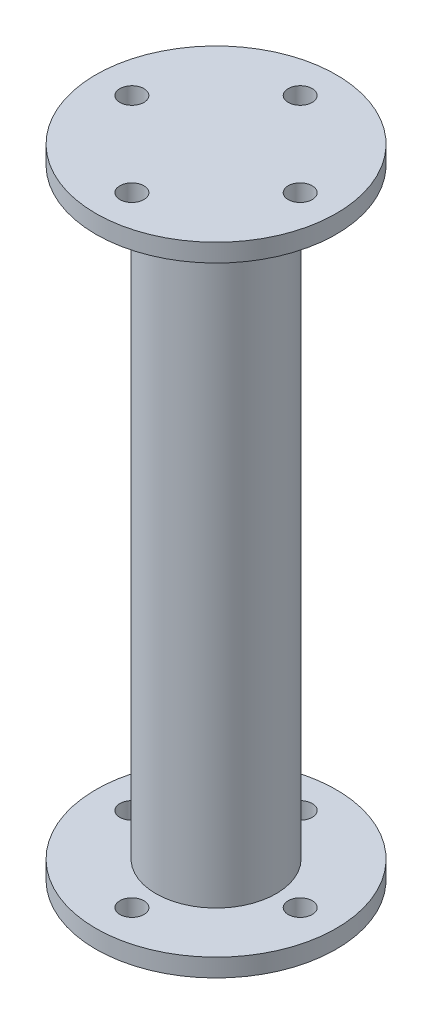
from build123d import *

# Parameters (mm, degrees)
SKETCH1_R           = 10
SKETCH1_R_2         = 2
SKETCH1_R_3         = 1
BOSS_EXTRUDE1_DEPTH = 1.5
SKETCH2_R           = 5
BOSS_EXTRUDE2_DEPTH = 50


with BuildPart() as part:
    # Sketch1 → Boss-Extrude1 (new body)
    # profile 1 of 2: a face of its own
    with BuildSketch(Plane(origin=(0, 0, 0), x_dir=(1, 0, 0), z_dir=(0, 1, 0))):
        with Locations(Location((0, 0, 0), (0, 0, 270))):
            Circle(SKETCH1_R)
        Circle(SKETCH1_R_2, mode=Mode.SUBTRACT)
        with Locations(Location((0, -7, 0), (0, 0, 270))):
            Circle(SKETCH1_R_3, mode=Mode.SUBTRACT)
        with Locations(Location((7, 0, 0), (0, 0, 270))):
            Circle(SKETCH1_R_3, mode=Mode.SUBTRACT)
        with Locations(Location((0, 7, 0), (0, 0, 270))):
            Circle(SKETCH1_R_3, mode=Mode.SUBTRACT)
        with Locations(Location((-7, 0, 0), (0, 0, 270))):
            Circle(SKETCH1_R_3, mode=Mode.SUBTRACT)
    # profile 2 of 2: a face of its own
    with BuildSketch(Plane(origin=(0, 0, 0), x_dir=(1, 0, 0), z_dir=(0, 1, 0))):
        Circle(SKETCH1_R_2)
    boss_extrude1 = extrude(amount=BOSS_EXTRUDE1_DEPTH)

    # Sketch2 → Boss-Extrude2 (add)
    with BuildSketch(Plane(origin=(0, 1.5, 0), x_dir=(1, 0, 0), z_dir=(0, 1, 0))):
        with Locations(Location((0, 0, 0), (0, 0, 270))):
            Circle(SKETCH2_R)
    extrude(amount=BOSS_EXTRUDE2_DEPTH)

    # Mirror1: Boss-Extrude1 across plane
    add(boss_extrude1.mirror(Plane.ZX.offset(26.5)))


solid = part.part
